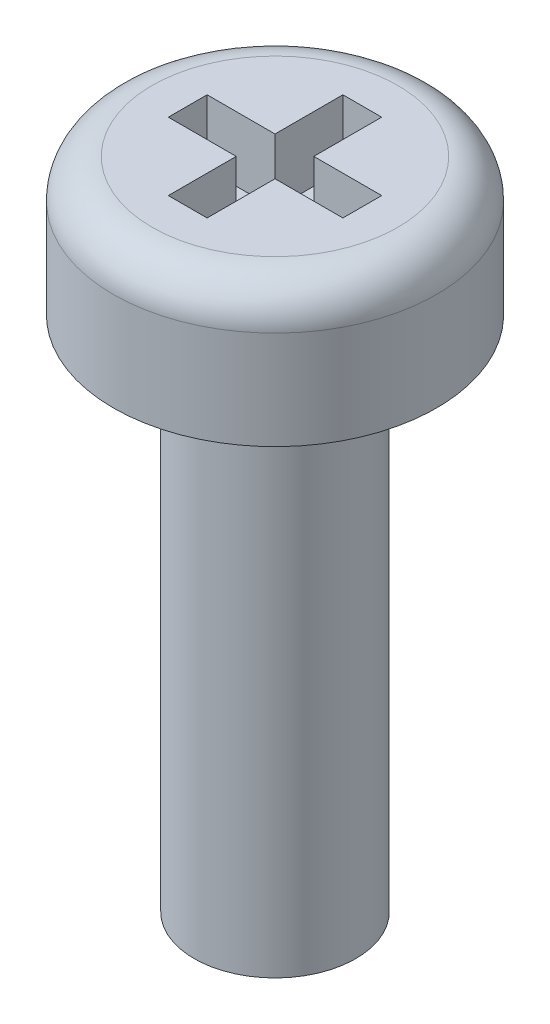
from build123d import *

# Parameters (mm, degrees)
CUT_EXTRUDE1_DEPTH = 1
FILLET1_R          = 0.6


with BuildPart() as part:
    # Sketch1 → Revolve1 (revolve)
    with BuildSketch(Plane.XY, mode=Mode.PRIVATE) as revolve1_sk:
        Polygon((0, 0), (0, 10.12), (2.5, 10.12), (2.5, 8), (1.25, 8), (1.25, 0), align=None)
    revolve(revolve1_sk.sketch.rotate(Axis((0, 0, 0), (0, 1, 0)), 90), axis=Axis((0, 0, 0), (0, 1, 0)))

    # Sketch2 → Cut-Extrude1 (cut)
    with BuildSketch(Plane(origin=(0, 10.12, 0), x_dir=(1, 0, 0), z_dir=(0, 1, 0))):
        Polygon((-0.3, 0.3), (-1.35, 0.3), (-1.35, -0.3), (-0.3, -0.3), (-0.3, -1.35), (0.3, -1.35), (0.3, -0.3), (1.35, -0.3), (1.35, 0.3), (0.3, 0.3), (0.3, 1.35), (-0.3, 1.35), align=None)
    extrude(amount=-CUT_EXTRUDE1_DEPTH, mode=Mode.SUBTRACT)

    # Fillet1
    fillet1_edges = [part.edges().sort_by_distance(p)[0] for p in [
        (0, 10.12, 2.5),
    ]]
    fillet(fillet1_edges, radius=FILLET1_R)


solid = part.part
